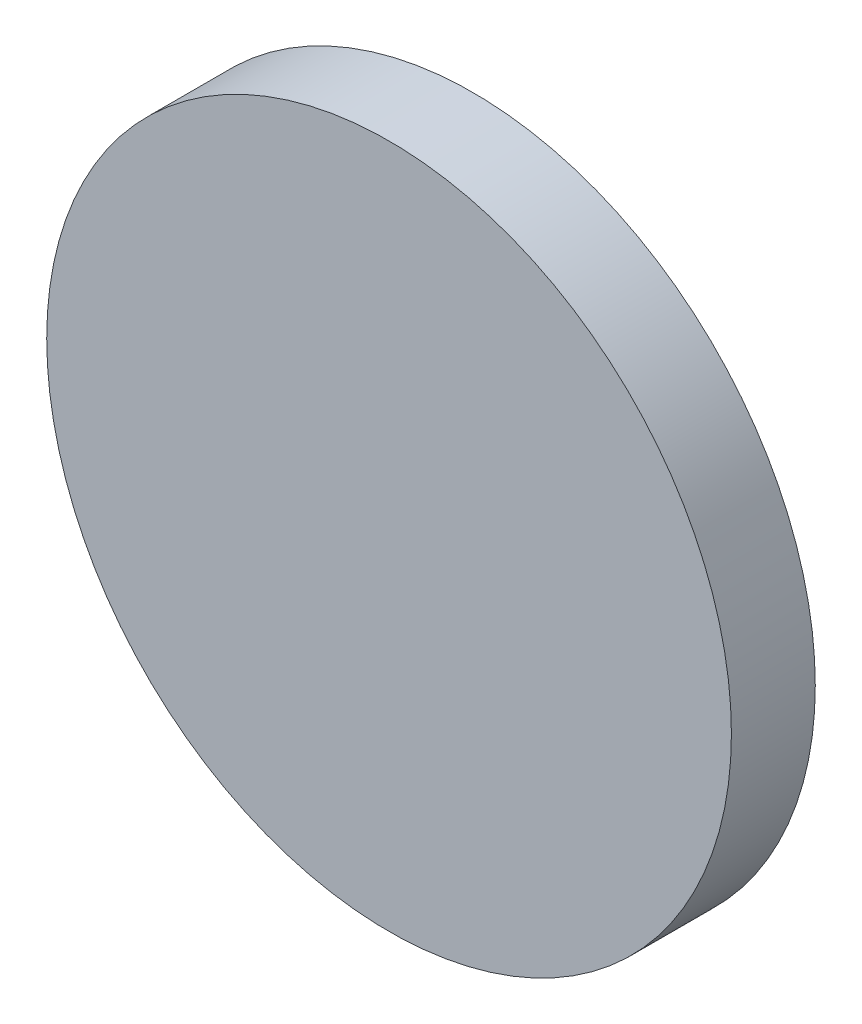
from build123d import *

# Parameters (mm, degrees)
SKETCH1_R           = 40.815010188
BOSS_EXTRUDE1_DEPTH = 10


with BuildPart() as part:
    # Sketch1 → Boss-Extrude1 (new body)
    with BuildSketch(Plane.XY):
        Circle(SKETCH1_R)
    extrude(amount=BOSS_EXTRUDE1_DEPTH)


solid = part.part
